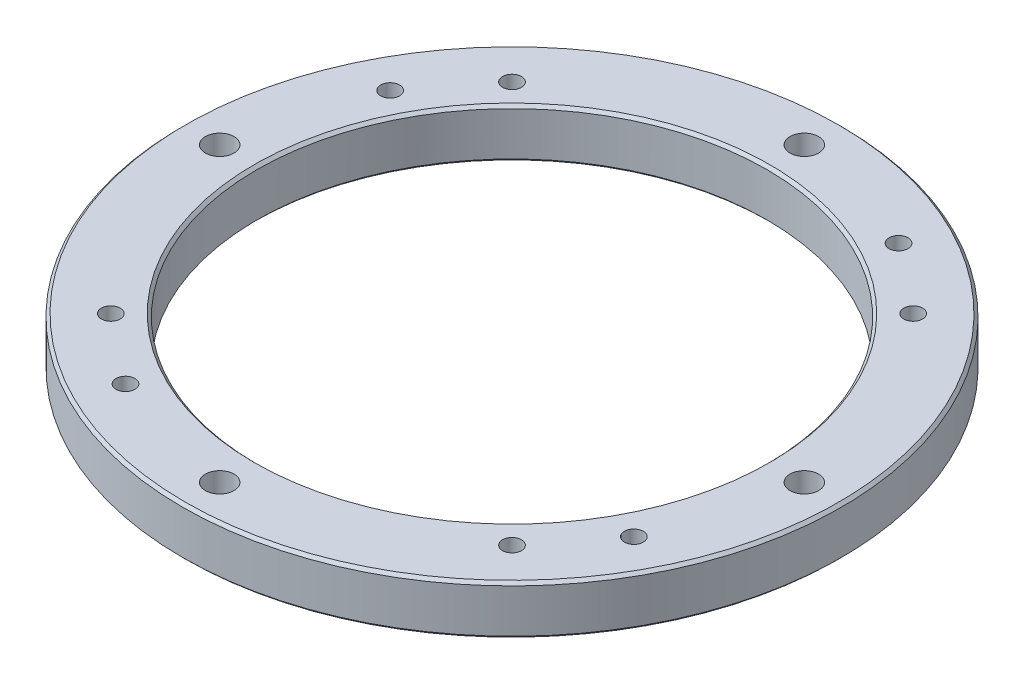
from build123d import *

# Parameters (mm, degrees)
SKETCH_1_R          = 57.5
SKETCH_1_R_2        = 44.5
EXTRUDE_1_DEPTH     = 8.6
SKETCH_2_R          = 2.5
CUT_EXTRUDE_1_DEPTH = 82.770777176
CHAMFER_1_SIZE      = 0.5
SKETCH_3_R          = 1.65
CUT_EXTRUDE_2_DEPTH = 82.770777176


with BuildPart() as part:
    # ｽｹｯﾁ1 → ﾎﾞｽ - 押し出し1 (new body)
    with BuildSketch(Plane(origin=(0, 0, 0), x_dir=(1, 0, 0), z_dir=(0, 1, 0))):
        with Locations(Location((0, 0, 0), (0, 0, 90))):
            Circle(SKETCH_1_R)
        with Locations(Location((0, 0, 0), (0, 0, 90))):
            Circle(SKETCH_1_R_2, mode=Mode.SUBTRACT)
    extrude(amount=EXTRUDE_1_DEPTH)

    # ｽｹｯﾁ2 → ｶｯﾄ - 押し出し1 (cut, through all)
    with BuildSketch(Plane(origin=(0, 8.6, 0), x_dir=(1, 0, 0), z_dir=(0, 1, 0))):
        with Locations(Location((-51, 0, 0), (0, 0, 270))):
            Circle(SKETCH_2_R)
        with Locations(Location((0, 51, 0), (0, 0, 270))):
            Circle(SKETCH_2_R)
        with Locations(Location((51, 0, 0), (0, 0, 270))):
            Circle(SKETCH_2_R)
        with Locations(Location((0, -51, 0), (0, 0, 270))):
            Circle(SKETCH_2_R)
    extrude(amount=-CUT_EXTRUDE_1_DEPTH, mode=Mode.SUBTRACT)

    # 面取り1
    chamfer_1_edges = [part.edges().sort_by_distance(p)[0] for p in [
        (0, 0, 57.5),
        (0, 8.6, 57.5),
        (0, 0, 44.5),
        (0, 8.6, 44.5),
    ]]
    chamfer(chamfer_1_edges, length=CHAMFER_1_SIZE)

    # ｽｹｯﾁ3 → ｶｯﾄ - 押し出し2 (cut, through all)
    with BuildSketch(Plane(origin=(0, 8.6, 0), x_dir=(1, 0, 0), z_dir=(0, 1, 0))):
        with Locations(Location((-35, 35, 0), (0, 0, 270))):
            Circle(SKETCH_3_R)
        with Locations(Location((-35, -35, 0), (0, 0, 270))):
            Circle(SKETCH_3_R)
        with Locations(Location((35, -35, 0), (0, 0, 270))):
            Circle(SKETCH_3_R)
        with Locations(Location((35, 35, 0), (0, 0, 270))):
            Circle(SKETCH_3_R)
        with Locations(Location((23.087430662, 44.350541659, 0), (0, 0, 270))):
            Circle(SKETCH_3_R)
        with Locations(Location((44.350541659, -23.087430662, 0), (0, 0, 270))):
            Circle(SKETCH_3_R)
        with Locations(Location((-23.087430662, -44.350541659, 0), (0, 0, 270))):
            Circle(SKETCH_3_R)
        with Locations(Location((-44.350541659, 23.087430662, 0), (0, 0, 270))):
            Circle(SKETCH_3_R)
    extrude(amount=-CUT_EXTRUDE_2_DEPTH, mode=Mode.SUBTRACT)


solid = part.part
